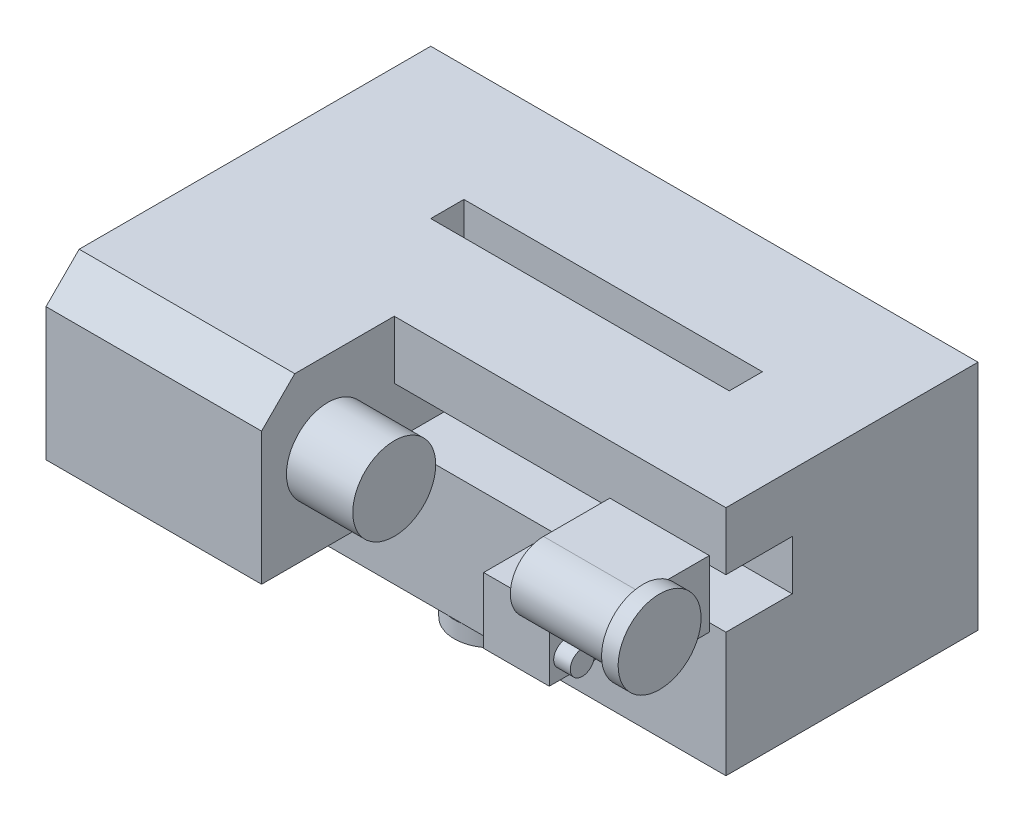
from build123d import *

# Parameters (mm, degrees)
SKETCH_1_W          = 165
SKETCH_1_H          = 70
EXTRUDE_1_DEPTH     = 116
SKETCH_2_W          = 100
SKETCH_2_H          = 40
CUT_EXTRUDE_1_DEPTH = 170.680327977
CUT_EXTRUDE_2_DEPTH = 70
SKETCH_4_W          = 49.486084661
SKETCH_4_H          = 20
CUT_EXTRUDE_3_DEPTH = 40
SKETCH_5_W          = 90
SKETCH_5_H          = 20
CUT_EXTRUDE_4_DEPTH = 20
SKETCH_6_R          = 12.5
EXTRUDE_2_DEPTH     = 20
SKETCH_7_W          = 100
SKETCH_7_H          = 15
CUT_EXTRUDE_5_DEPTH = 20
SKETCH_8_W          = 30
SKETCH_8_H          = 20
EXTRUDE_3_DEPTH     = 30
CUT_EXTRUDE_6_DEPTH = 30
SKETCH_10_R         = 12.5
EXTRUDE_5_DEPTH     = 5
SKETCH_11_W         = 90
SKETCH_11_H         = 10
CUT_EXTRUDE_7_DEPTH = 170.680327977
SKETCH_12_W         = 19.793287236
SKETCH_12_H         = 19.804361638
EXTRUDE_6_DEPTH     = 15
SKETCH_13_R         = 11.356941905
SKETCH_13_R_2       = 5.84992953
EXTRUDE_7_DEPTH     = 5
SKETCH_14_R         = 3.636100405
EXTRUDE_8_DEPTH     = 5
SCALE_1_SCALE       = 10


with BuildPart() as part:
    # ｽｹｯﾁ1 → ﾎﾞｽ - 押し出し1 (new body)
    with BuildSketch(Plane.XY):
        with Locations((19.653872675, 23.252863688)):
            Rectangle(SKETCH_1_W, SKETCH_1_H)
    extrude(amount=EXTRUDE_1_DEPTH)

    # ｽｹｯﾁ2 → ｶｯﾄ - 押し出し1 (cut, through all)
    with BuildSketch(Plane(origin=(0, -11.747136312, 0), x_dir=(-1, 0, 0), z_dir=(0, -1, 0))):
        with Locations((-52.153872675, -96)):
            Rectangle(SKETCH_2_W, SKETCH_2_H)
    extrude(amount=-CUT_EXTRUDE_1_DEPTH, mode=Mode.SUBTRACT)

    # ｽｹｯﾁ3 → ｶｯﾄ - 押し出し2 (cut)
    with BuildSketch(Plane.ZY.offset(62.846127325)):
        Polygon((116, -11.747136312), (116, 8.252863688), (86, -11.747136312), align=None)
        Polygon((116, 58.252863688), (106, 58.252863688), (116, 48.252863688), align=None)
    extrude(amount=-CUT_EXTRUDE_2_DEPTH, mode=Mode.SUBTRACT)

    # ｽｹｯﾁ4 → ｶｯﾄ - 押し出し3 (cut)
    with BuildSketch(Plane.XY.offset(116)):
        with Locations((-22.589169656, -1.747136312)):
            Rectangle(SKETCH_4_W, SKETCH_4_H)
    extrude(amount=-CUT_EXTRUDE_3_DEPTH, mode=Mode.SUBTRACT)

    # ｽｹｯﾁ5 → ｶｯﾄ - 押し出し4 (cut)
    with BuildSketch(Plane(origin=(0, -11.747136312, 0), x_dir=(-1, 0, 0), z_dir=(0, -1, 0))):
        with Locations((-19.653872675, -10)):
            Rectangle(SKETCH_5_W, SKETCH_5_H)
    extrude(amount=-CUT_EXTRUDE_4_DEPTH, mode=Mode.SUBTRACT)

    # ｽｹｯﾁ6 → ﾎﾞｽ - 押し出し2 (add)
    with BuildSketch(Plane(origin=(2.153872675, 0, 0), x_dir=(0, 0, -1), z_dir=(1, 0, 0))):
        with Locations(Location((-96, 33.252863688, 0), (0, 0, 180))):
            Circle(SKETCH_6_R)
    extrude(amount=EXTRUDE_2_DEPTH)

    # ｽｹｯﾁ7 → ｶｯﾄ - 押し出し5 (cut)
    with BuildSketch(Plane.XY.offset(76)):
        with Locations((52.153872675, 33.252863688)):
            Rectangle(SKETCH_7_W, SKETCH_7_H)
    extrude(amount=-CUT_EXTRUDE_5_DEPTH, mode=Mode.SUBTRACT)

    # ｽｹｯﾁ8 → ﾎﾞｽ - 押し出し3 (add)
    with BuildSketch(Plane.XY.offset(76)):
        with Locations((82.153872675, 33.252863688)):
            Rectangle(SKETCH_8_W, SKETCH_8_H)
    extrude(amount=EXTRUDE_3_DEPTH)

    # ｽｹｯﾁ9 → ｶｯﾄ - 押し出し6 (cut)
    with BuildSketch(Plane(origin=(97.153872675, 0, 0), x_dir=(0, 0, -1), z_dir=(1, 0, 0))):
        with BuildLine():
            ThreePointArc((-106, 33.252863688), (-103.071067812, 40.3239315), (-96, 43.252863688))
            Line((-96, 43.252863688), (-106, 43.252863688))
            Line((-106, 43.252863688), (-106, 33.252863688))
        make_face()
        with BuildLine():
            ThreePointArc((-96, 23.252863688), (-103.071067812, 26.181795877), (-106, 33.252863688))
            Line((-106, 33.252863688), (-106, 23.252863688))
            Line((-106, 23.252863688), (-96, 23.252863688))
        make_face()
    extrude(amount=-CUT_EXTRUDE_6_DEPTH, mode=Mode.SUBTRACT)

    # ｽｹｯﾁ10 → ﾎﾞｽ - 押し出し5 (add)
    with BuildSketch(Plane(origin=(97.153872675, 0, 0), x_dir=(0, 0, -1), z_dir=(1, 0, 0))):
        with Locations(Location((-96, 33.252863688, 0), (0, 0, 180))):
            Circle(SKETCH_10_R)
    extrude(amount=EXTRUDE_5_DEPTH)

    # ｽｹｯﾁ11 → ｶｯﾄ - 押し出し7 (cut, through all)
    with BuildSketch(Plane.XZ.offset(11.747136312)):
        with Locations((27.153872675, 40)):
            Rectangle(SKETCH_11_W, SKETCH_11_H)
    extrude(amount=-CUT_EXTRUDE_7_DEPTH, mode=Mode.SUBTRACT)

    # ｽｹｯﾁ12 → ﾎﾞｽ - 押し出し6 (add)
    with BuildSketch(Plane.XY.offset(76)):
        with Locations((53.995302242, 9.902180819)):
            Rectangle(SKETCH_12_W, SKETCH_12_H)
    extrude(amount=EXTRUDE_6_DEPTH)

    # ｽｹｯﾁ13 → ﾎﾞｽ - 押し出し7 (add)
    with BuildSketch(Plane(origin=(0, -11.747136312, 0), x_dir=(-1, 0, 0), z_dir=(0, -1, 0))):
        with Locations(Location((-20.471789783, -64.844641849, 0), (0, 0, 280.811331396))):
            Circle(SKETCH_13_R)
        with Locations(Location((-48.379056958, -62.343196008, 0), (0, 0, 270))):
            Circle(SKETCH_13_R_2)
    extrude(amount=EXTRUDE_7_DEPTH)

    # ｽｹｯﾁ14 → ﾎﾞｽ - 押し出し8 (add)
    with BuildSketch(Plane(origin=(63.89194586, 0, 0), x_dir=(0, 0, -1), z_dir=(1, 0, 0))):
        with Locations(Location((-86.03727841, 6.236286701, 0), (0, 0, 180))):
            Circle(SKETCH_14_R)
    extrude(amount=EXTRUDE_8_DEPTH)


with BuildPart() as part_1:
    # ｽｹｰﾙ1: scaled about (12.08683356, 25.131751334, 48.498774543)
    add(part.part.scale(SCALE_1_SCALE).moved(Location((-108.78150204, -226.185762006, -436.488970887))))


solid = part_1.part
